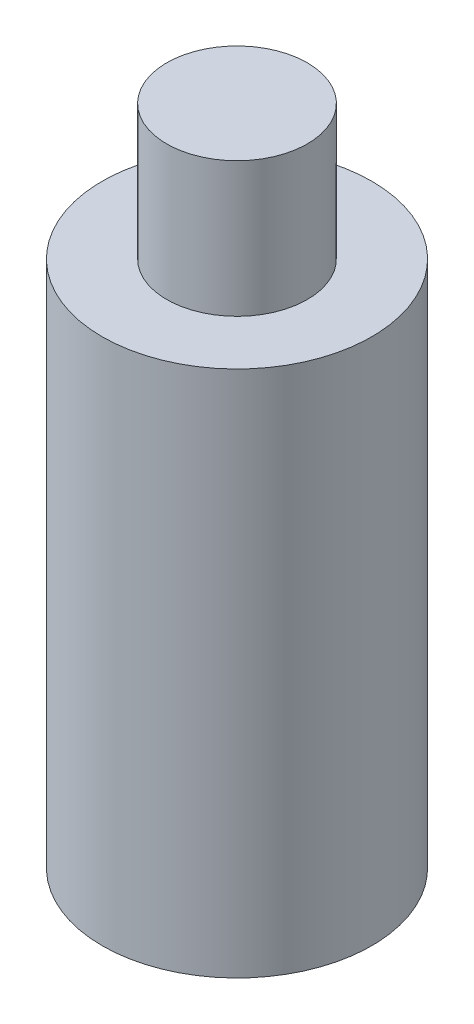
from build123d import *

# Parameters (mm, degrees)
SKETCH1_R           = 7.62
BOSS_EXTRUDE1_DEPTH = 29.8196
SKETCH2_R           = 3.975
BOSS_EXTRUDE2_DEPTH = 7.62
SKETCH3_R           = 1.1938
CUT_EXTRUDE1_DEPTH  = 7.8232


with BuildPart() as part:
    # Sketch1 → Boss-Extrude1 (new body)
    with BuildSketch(Plane(origin=(0, 0, 0), x_dir=(1, 0, 0), z_dir=(0, 1, 0))):
        with Locations(Location((0, 0, 0), (0, 0, 270))):
            Circle(SKETCH1_R)
    extrude(amount=BOSS_EXTRUDE1_DEPTH)

    # Sketch2 → Boss-Extrude2 (add)
    with BuildSketch(Plane(origin=(0, 29.8196, 0), x_dir=(1, 0, 0), z_dir=(0, 1, 0))):
        with Locations(Location((0, 0, 0), (0, 0, 90))):
            Circle(SKETCH2_R)
    extrude(amount=BOSS_EXTRUDE2_DEPTH)

    # Sketch3 → Cut-Extrude1 (cut)
    with BuildSketch(Plane.XZ):
        with Locations(Location((-5.08, 0, 0), (0, 0, 270))):
            Circle(SKETCH3_R)
        with Locations(Location((5.08, 0, 0), (0, 0, 270))):
            Circle(SKETCH3_R)
    extrude(amount=-CUT_EXTRUDE1_DEPTH, mode=Mode.SUBTRACT)


solid = part.part
